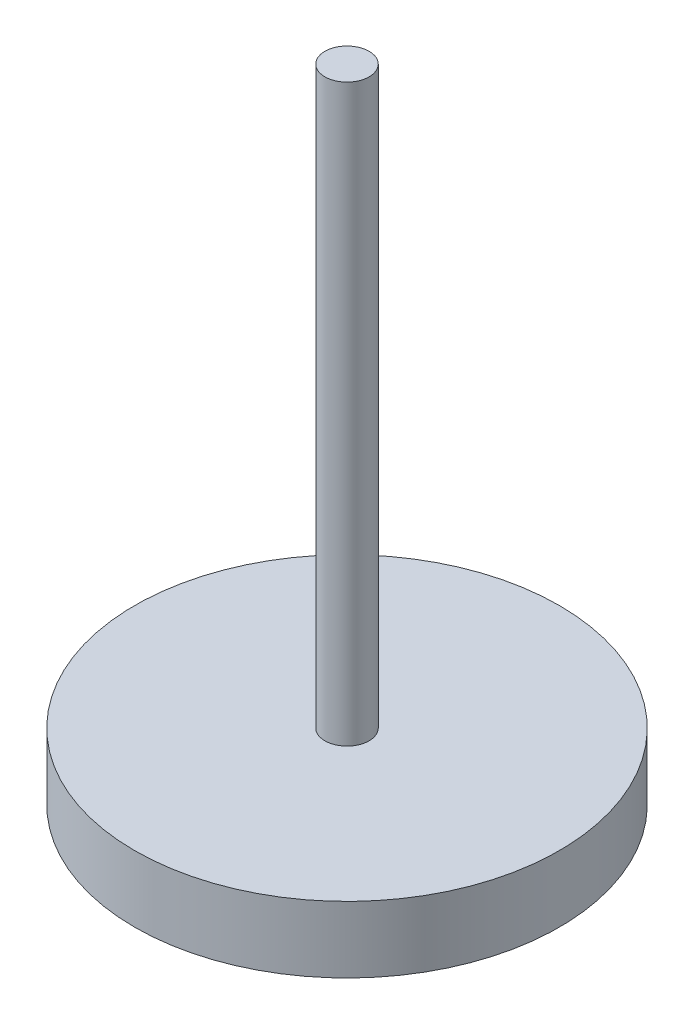
from build123d import *

# Parameters (mm, degrees)
SKETCH2_R           = 48
BOSS_EXTRUDE1_DEPTH = 15
SKETCH3_R           = 5
BOSS_EXTRUDE2_DEPTH = 130


with BuildPart() as part:
    # Sketch2 → Boss-Extrude1 (new body)
    with BuildSketch(Plane(origin=(0, 0, 0), x_dir=(1, 0, 0), z_dir=(0, 1, 0))):
        with Locations(Location((0, 0, 0), (0, 0, 270))):
            Circle(SKETCH2_R)
    extrude(amount=BOSS_EXTRUDE1_DEPTH)

    # Sketch3 → Boss-Extrude2 (add)
    with BuildSketch(Plane(origin=(0, 15, 0), x_dir=(1, 0, 0), z_dir=(0, 1, 0))):
        with Locations(Location((0, 0, 0), (0, 0, 270))):
            Circle(SKETCH3_R)
    extrude(amount=BOSS_EXTRUDE2_DEPTH)


solid = part.part
